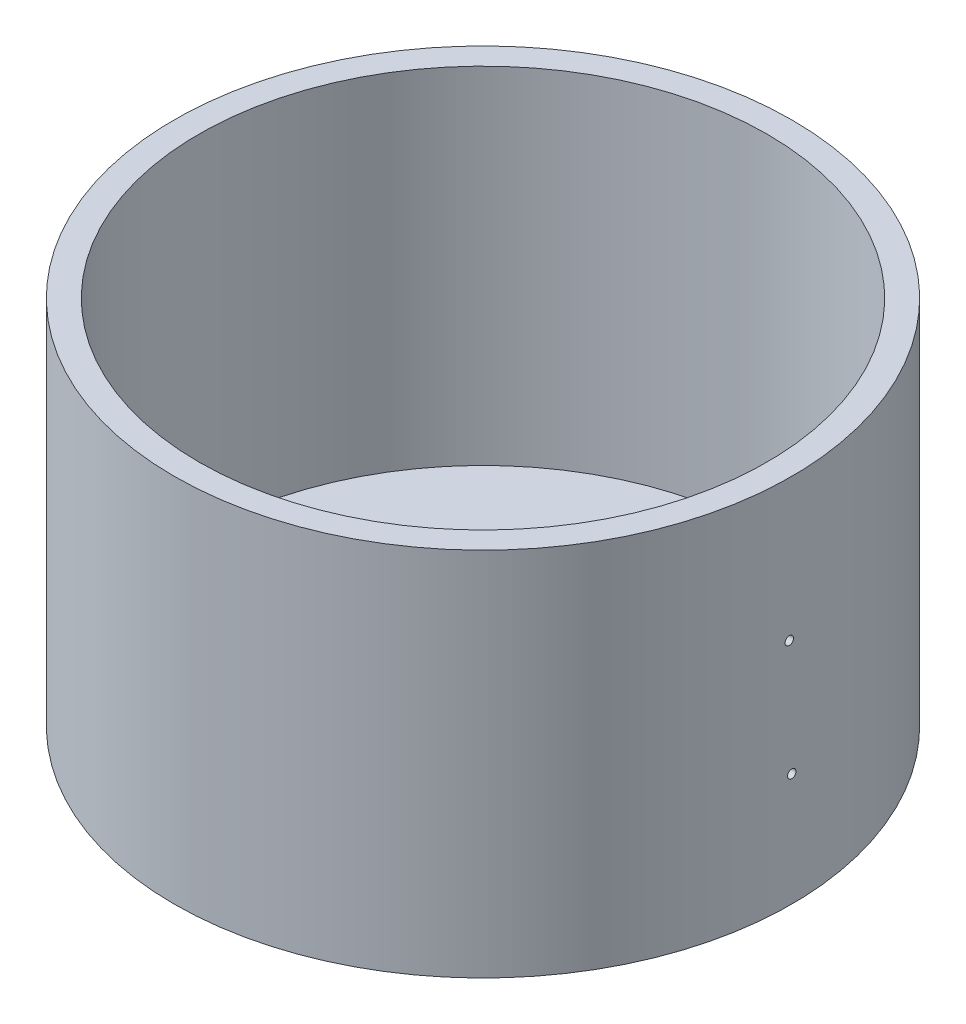
from build123d import *

# Parameters (mm, degrees)
SKETCH1_R                         = 12.5
SKETCH1_R_2                       = 11.5
BOSS_EXTRUDE1_DEPTH               = 14
BOSS_EXTRUDE2_START               = 1
SKETCH2_R                         = 12.5
SKETCH2_R_2                       = 7.5
BOSS_EXTRUDE2_DEPTH               = 1
F_80_0_0135_DIAMETER_HOLE1_REACH  = 31.497
F_80_0_0135_DIAMETER_HOLE1_BORE_R = 0.17145
F_80_0_0135_DIAMETER_HOLE2_REACH  = 31.833
F_80_0_0135_DIAMETER_HOLE2_BORE_R = 0.17145


with BuildPart() as part:
    # Sketch1 → Boss-Extrude1 (new body)
    with BuildSketch(Plane(origin=(0, 0, 0), x_dir=(1, 0, 0), z_dir=(0, 1, 0))):
        with Locations(Location((0, 0, 0), (0, 0, 270))):
            Circle(SKETCH1_R)
        with Locations(Location((0, 0, 0), (0, 0, 270))):
            Circle(SKETCH1_R_2, mode=Mode.SUBTRACT)
    extrude(amount=BOSS_EXTRUDE1_DEPTH)

    # Sketch2 → Boss-Extrude2 (add)
    with BuildSketch(Plane(origin=(0, 0, 0), x_dir=(-1, 0, 0), z_dir=(0, -1, 0)).offset(BOSS_EXTRUDE2_START)):
        with Locations(Location((0, 0, 0), (0, 0, 90))):
            Circle(SKETCH2_R)
        with Locations(Location((0, 0, 0), (0, 0, 90))):
            Circle(SKETCH2_R_2, mode=Mode.SUBTRACT)
    extrude(amount=-BOSS_EXTRUDE2_DEPTH)

    # #80 (0.0135) Diameter Hole1 bore (on position points) → #80 (0.0135) Diameter Hole1 (cut, up to next)
    with BuildSketch(Plane(origin=(12.499604816, 8.291561976, 0.099395334), x_dir=(-0.00795162675, 0, 0.999968385316), z_dir=(0.999968385316, 0, 0.00795162675)), mode=Mode.PRIVATE) as f_80_0_0135_diameter_hole1_sk1:
        Circle(F_80_0_0135_DIAMETER_HOLE1_BORE_R)
    f_80_0_0135_diameter_hole1_tool1 = extrude(f_80_0_0135_diameter_hole1_sk1.sketch, amount=-F_80_0_0135_DIAMETER_HOLE1_REACH, mode=Mode.PRIVATE) & part.part
    add(f_80_0_0135_diameter_hole1_tool1.solids().sort_by_distance((12.499605, 8.291562, 0.099395))[0], mode=Mode.SUBTRACT)

    # #80 (0.0135) Diameter Hole2 bore (on position points) → #80 (0.0135) Diameter Hole2 (cut, up to next)
    with BuildSketch(Plane(origin=(12.5, 3.570714214, 0), x_dir=(0, 0, 1), z_dir=(1, 0, 0)), mode=Mode.PRIVATE) as f_80_0_0135_diameter_hole2_sk1:
        Circle(F_80_0_0135_DIAMETER_HOLE2_BORE_R)
    f_80_0_0135_diameter_hole2_tool1 = extrude(f_80_0_0135_diameter_hole2_sk1.sketch, amount=-F_80_0_0135_DIAMETER_HOLE2_REACH, mode=Mode.PRIVATE) & part.part
    add(f_80_0_0135_diameter_hole2_tool1.solids().sort_by_distance((12.5, 3.570714, 0))[0], mode=Mode.SUBTRACT)


solid = part.part
